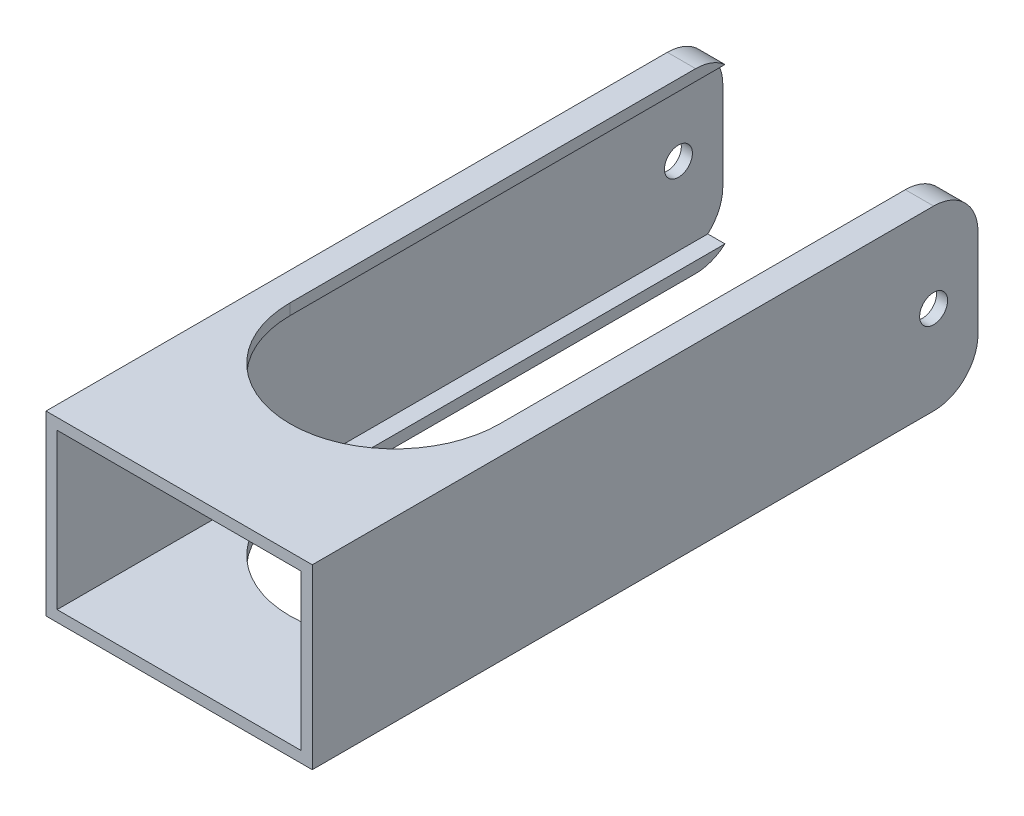
from build123d import *

# Parameters (mm, degrees)
BOSS_EXTRUDE1_DEPTH      = 95.25
BOSS_EXTRUDE1_DEPTH_BACK = 95.25
SKETCH3_W                = 76.2
SKETCH3_H                = 50.8
SKETCH3_W_2              = 69.85
SKETCH3_H_2              = 44.45
CUT_EXTRUDE1_DEPTH       = 115.476252996
CUT_EXTRUDE1_DEPTH_BACK  = 115.476252996
SKETCH7_R                = 4
CUT_EXTRUDE2_DEPTH       = 125.595997127
FILLET1_R                = 12.7


with BuildPart() as part:
    # Sketch3 → Boss-Extrude1 (new, two sides: drawn at the far end of the back side and taken through both)
    with BuildSketch(Plane.XY.offset(-BOSS_EXTRUDE1_DEPTH_BACK)):
        Rectangle(SKETCH3_W, SKETCH3_H)
        Rectangle(SKETCH3_W_2, SKETCH3_H_2, mode=Mode.SUBTRACT)
    extrude(amount=BOSS_EXTRUDE1_DEPTH + BOSS_EXTRUDE1_DEPTH_BACK)

    # Sketch6 → Cut-Extrude1 (cut, two sides: drawn at the far end of the back side and taken through both)
    with BuildSketch(Plane(origin=(0, 25.4, 0), x_dir=(1, 0, 0), z_dir=(0, 1, 0)).offset(-CUT_EXTRUDE1_DEPTH_BACK)):
        with BuildLine():
            Line((30, 95.25), (-30, 95.25))
            Line((-30, 95.25), (-30, -33.5))
            ThreePointArc((-30, -33.5), (0, -63.5), (30, -33.5))
            Line((30, -33.5), (30, 95.25))
        make_face()
    extrude(amount=CUT_EXTRUDE1_DEPTH + CUT_EXTRUDE1_DEPTH_BACK, mode=Mode.SUBTRACT)

    # Sketch7 → Cut-Extrude2 (cut, through all)
    with BuildSketch(Plane(origin=(38.1, 0, 0), x_dir=(0, 0, -1), z_dir=(1, 0, 0))):
        with Locations((82.55, 0)):
            Circle(SKETCH7_R)
    extrude(amount=-CUT_EXTRUDE2_DEPTH, mode=Mode.SUBTRACT)

    # Fillet1
    fillet1_edges = [part.edges().sort_by_distance(p)[0] for p in [
        (-34.05, -25.4, -95.25),
        (-34.05, 25.4, -95.25),
        (34.05, -25.4, -95.25),
        (34.05, 25.4, -95.25),
    ]]
    fillet(fillet1_edges, radius=FILLET1_R)


solid = part.part
